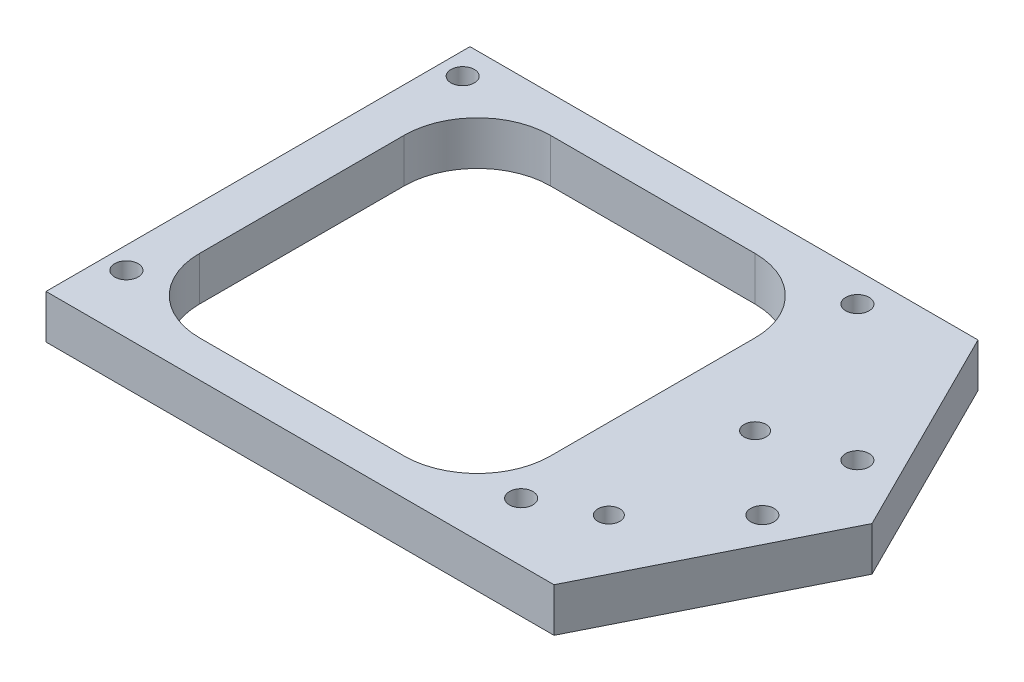
from build123d import *

# Parameters (mm, degrees)
BOSS_EXTRUDE1_DEPTH     = 1.5
CUT_EXTRUDE1_DEPTH      = 52.061237744
CUT_EXTRUDE1_DEPTH_BACK = 52.061237744
SKETCH2_W               = 24
SKETCH2_H               = 24
FILLET1_R               = 5
M2X0_4_TAPPED_HOLE1_D   = 1.6
F_1_5MM_DOWEL_HOLE1_D   = 1.5


with BuildPart() as part:
    # Sketch1 → Boss-Extrude1 (new, symmetric)
    with BuildSketch(Plane(origin=(0, 0, 0), x_dir=(1, 0, 0), z_dir=(0, 1, 0))):
        Polygon((0, 0), (34.748434417, 0), (42, 14.5), (34.748434417, 29), (0, 29), align=None)
    extrude(amount=BOSS_EXTRUDE1_DEPTH, both=True)

    # Sketch2 → Cut-Extrude1 (cut, two sides: drawn at the far end of the back side and taken through both)
    with BuildSketch(Plane(origin=(0, 0, 0), x_dir=(1, 0, 0), z_dir=(0, 1, 0)).offset(-CUT_EXTRUDE1_DEPTH_BACK)):
        with Locations((15, 14.5)):
            Rectangle(SKETCH2_W, SKETCH2_H)
    extrude(amount=CUT_EXTRUDE1_DEPTH + CUT_EXTRUDE1_DEPTH_BACK, mode=Mode.SUBTRACT)

    # Fillet1
    fillet1_edges = [part.edges().sort_by_distance(p)[0] for p in [
        (3, 0, -2.5),
        (3, 0, -26.5),
        (27, 0, -26.5),
        (27, 0, -2.5),
    ]]
    fillet(fillet1_edges, radius=FILLET1_R)

    # M2x0.4 Tapped Hole1 (through all)
    with Locations(Plane(origin=(1.5, 1.5, -27), x_dir=(0, 0, 1), z_dir=(0, 1, 0))):
        with Locations((0, 0), (0, 27), (9.25, 36.248434417), (15.75, 36.248434417), (23, 27), (23, 0)):
            Hole(M2X0_4_TAPPED_HOLE1_D / 2)

    # Ø1.5mm Dowel Hole1 (through all)
    with Locations(Plane(origin=(32.5, 1.5, -16), x_dir=(0, 0, 1), z_dir=(0, 1, 0))):
        with Locations((0, 0), (10, 0)):
            Hole(F_1_5MM_DOWEL_HOLE1_D / 2)


solid = part.part
